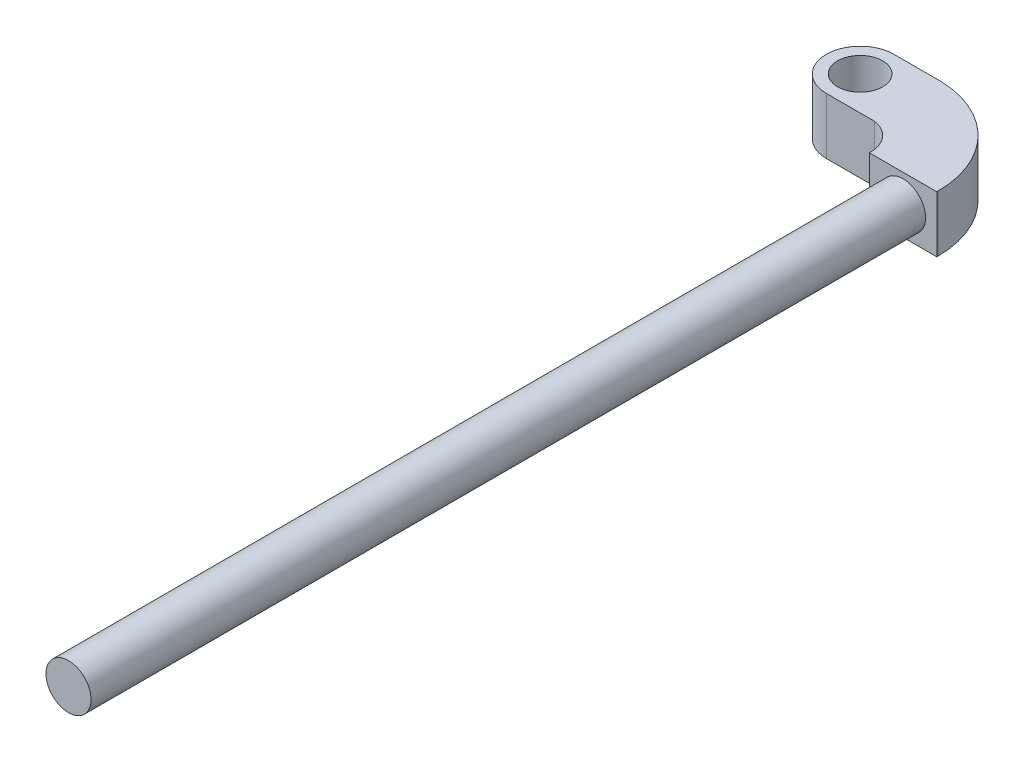
from build123d import *

# Parameters (mm, degrees)
SKETCH_2_R          = 2
EXTRUDE_2_DEPTH     = 5
EXTRUDE_3_DEPTH     = 5
SKETCH_4_OUTSIDE_W  = 34.301
SKETCH_4_OUTSIDE_H  = 23.848
SKETCH_4_OUTSIDE_R  = 2
CUT_EXTRUDE_1_DEPTH = 74


with BuildPart() as part:
    # 草图2 → 凸台-拉伸2 (new body)
    with BuildSketch(Plane(origin=(0, 0, 0), x_dir=(1, 0, 0), z_dir=(0, 1, 0))):
        with BuildLine():
            Line((-3.932336285, 3), (0.337762879, 3))
            Line((0.337762879, 3), (0.337762879, -3))
            Line((0.337762879, -3), (-3.932336285, -3))
            ThreePointArc((-3.932336285, -3), (-6.932336285, 0), (-3.932336285, 3))
        make_face()
        with Locations(Location((-3.932336285, 0, 0), (0, 0, 270))):
            Circle(SKETCH_2_R, mode=Mode.SUBTRACT)
    extrude(amount=EXTRUDE_2_DEPTH)

    # 草图3 → 凸台-拉伸3 (add)
    with BuildSketch(Plane(origin=(0, 0, 0), x_dir=(1, 0, 0), z_dir=(0, 1, 0))):
        with BuildLine():
            Line((2.537654461, -79.655778605), (8.520746385, -79.655778605))
            Line((8.520746385, -79.655778605), (8.520746385, -8.429696767))
            Line((8.520746385, -8.429696767), (8.520746385, -5.525308021))
            ThreePointArc((8.520746385, -5.525308021), (6.143965834, 0.383204819), (0.337762879, 3))
            Line((0.337762879, 3), (0.337762879, -3))
            ThreePointArc((0.337762879, -3), (1.910553846, -3.850740646), (2.537654461, -5.525308021))
            Line((2.537654461, -5.525308021), (2.537654461, -8.429696767))
            Line((2.537654461, -8.429696767), (2.537654461, -79.655778605))
        make_face()
    extrude(amount=EXTRUDE_3_DEPTH)

    # 草图4 outside → 切除-拉伸1 (cut)
    with BuildSketch(Plane.XY.offset(79.655778605)):
        with Locations((0.7945, 2.5)):
            Rectangle(SKETCH_4_OUTSIDE_W, SKETCH_4_OUTSIDE_H)
        with Locations((5.529200423, 2.5)):
            Circle(SKETCH_4_OUTSIDE_R, mode=Mode.SUBTRACT)
    extrude(amount=-CUT_EXTRUDE_1_DEPTH, mode=Mode.SUBTRACT)


solid = part.part
